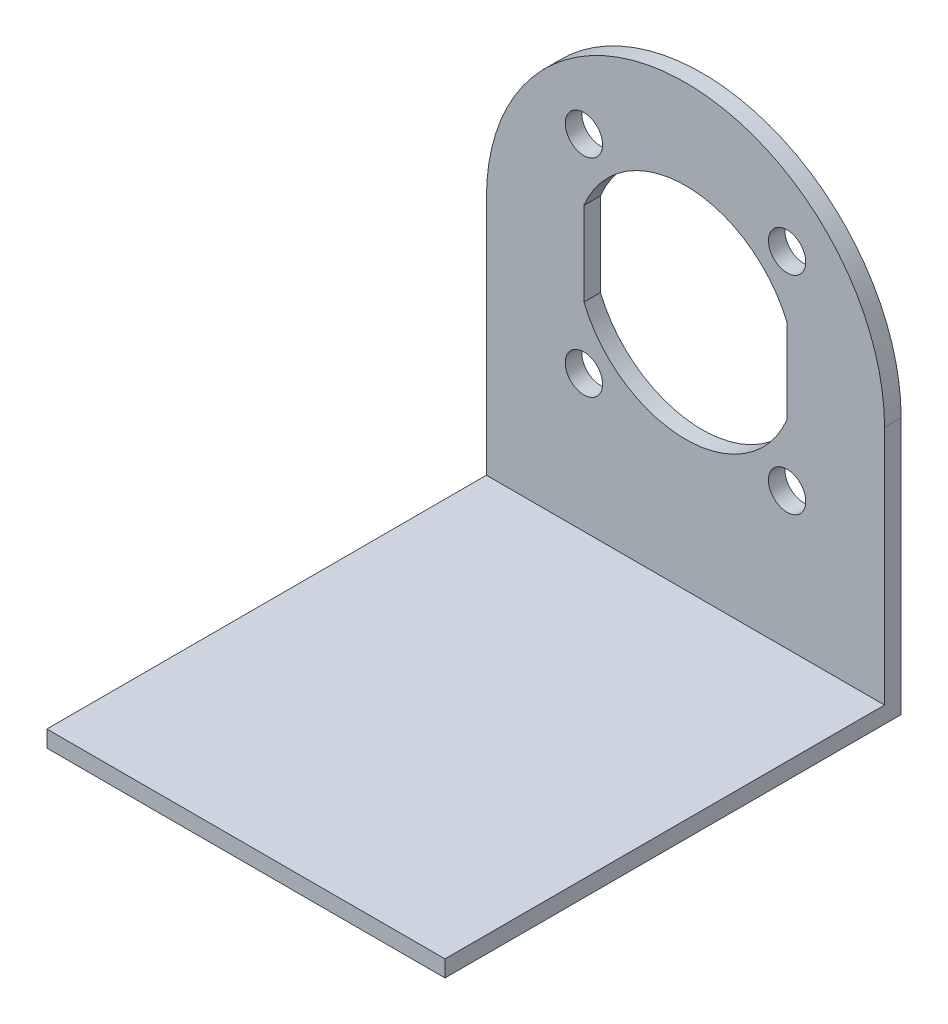
from build123d import *

# Parameters (mm, degrees)
SKETCH1_W           = 48
SKETCH1_H           = 55
BOSS_EXTRUDE1_DEPTH = 2
SKETCH2_W           = 48
SKETCH2_H           = 2
BOSS_EXTRUDE2_DEPTH = 53
CUT_EXTRUDE1_DEPTH  = 53
CUT_EXTRUDE2_DEPTH  = 53
SKETCH5_R           = 2.25
CUT_EXTRUDE3_DEPTH  = 53


with BuildPart() as part:
    # Sketch1 → Boss-Extrude1 (new body)
    with BuildSketch(Plane(origin=(0, 0, 0), x_dir=(1, 0, 0), z_dir=(0, 1, 0))):
        with Locations((-14.771122877, 6.689300827)):
            Rectangle(SKETCH1_W, SKETCH1_H)
    extrude(amount=BOSS_EXTRUDE1_DEPTH)

    # Sketch2 → Boss-Extrude2 (add)
    with BuildSketch(Plane(origin=(0, 2, 0), x_dir=(1, 0, 0), z_dir=(0, 1, 0))):
        with Locations((-14.771122877, 33.189300827)):
            Rectangle(SKETCH2_W, SKETCH2_H)
    extrude(amount=BOSS_EXTRUDE2_DEPTH)

    # Sketch3 → Cut-Extrude1 (cut)
    with BuildSketch(Plane.XY.offset(-32.189300827)):
        with BuildLine():
            Line((-14.771122877, 55), (-38.771122877, 55))
            Line((-38.771122877, 55), (-38.771122877, 31))
            ThreePointArc((-38.771122877, 31), (-31.741685625, 47.970562748), (-14.771122877, 55))
        make_face()
        with BuildLine():
            Line((9.228877123, 55), (-14.771122877, 55))
            ThreePointArc((-14.771122877, 55), (2.199439872, 47.970562748), (9.228877123, 31))
            Line((9.228877123, 31), (9.228877123, 55))
        make_face()
    extrude(amount=-CUT_EXTRUDE1_DEPTH, mode=Mode.SUBTRACT)

    # Sketch4 → Cut-Extrude2 (cut)
    with BuildSketch(Plane.XY.offset(-32.189300827)):
        with BuildLine():
            Line((-27.021122877, 25.950247531), (-27.021122877, 36.049752469))
            ThreePointArc((-27.021122877, 36.049752469), (-14.771122877, 44.25), (-2.521122877, 36.049752469))
            Line((-2.521122877, 36.049752469), (-2.521122877, 25.950247531))
            ThreePointArc((-2.521122877, 25.950247531), (-14.771122877, 17.75), (-27.021122877, 25.950247531))
        make_face()
    extrude(amount=-CUT_EXTRUDE2_DEPTH, mode=Mode.SUBTRACT)

    # Sketch5 → Cut-Extrude3 (cut)
    with BuildSketch(Plane.XY.offset(-32.189300827)):
        with Locations((-27.021122877, 43.49749975)):
            Circle(SKETCH5_R)
        with Locations((-2.521122877, 43.49749975)):
            Circle(SKETCH5_R)
        with Locations((-27.021122877, 18.50250025)):
            Circle(SKETCH5_R)
        with Locations((-2.521122877, 18.50250025)):
            Circle(SKETCH5_R)
    extrude(amount=-CUT_EXTRUDE3_DEPTH, mode=Mode.SUBTRACT)


solid = part.part
